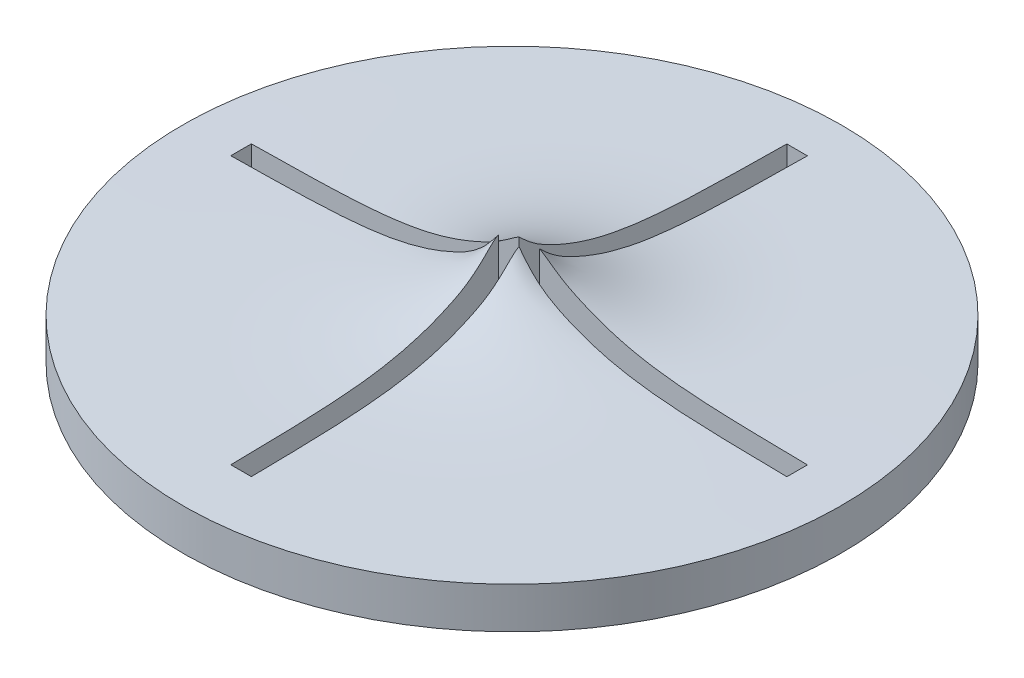
from build123d import *

# Parameters (mm, degrees)
CUT_EXTRUDE1_DEPTH = 2


with BuildPart() as part:
    # Sketch2 → Revolve1 (revolve)
    with BuildSketch(Plane.XY, mode=Mode.PRIVATE) as revolve1_sk:
        with BuildLine():
            Line((0, 1.022687254), (0, 1.522687254))
            add(Edge.make_bspline(
                [(4, 0.5), (2.192993628, 0.530019701), (1.206834054, 0.487935123), (0.229066118, 1.089665754), (0, 1.522687254)],
                knots=[0, 0, 0, 0, 0.784163654, 1, 1, 1, 1], degree=3))
            Line((4, 0.5), (4, 0))
            add(Edge.make_bspline(
                [(4, 0), (2.192993628, 0.030019701), (1.206852605, -0.012201872), (0.23146911, 0.571920481), (0, 1.022687254)],
                knots=[0, 0, 0, 0, 0.784163654, 1, 1, 1, 1], degree=3))
        make_face()
    revolve(revolve1_sk.sketch.rotate(Axis((0, 1.022687254, 0), (0, 1, 0)), 90), axis=Axis((0, 1.022687254, 0), (0, 1, 0)))

    # Sketch3 → Cut-Extrude1 (cut)
    with BuildSketch(Plane(origin=(0, 0, 0), x_dir=(1, 0, 0), z_dir=(0, 1, 0))):
        Polygon((-0.125, 0.211338411), (-0.125, 3.461338411), (0.125, 3.461338411), (0.125, 0.211338411), (3.375, 0.211338411), (3.375, -0.038661589), (0.125, -0.038661589), (0.125, -3.288661589), (-0.125, -3.288661589), (-0.125, -0.038661589), (-3.375, -0.038661589), (-3.375, 0.211338411), align=None)
    extrude(amount=CUT_EXTRUDE1_DEPTH, mode=Mode.SUBTRACT)


solid = part.part
